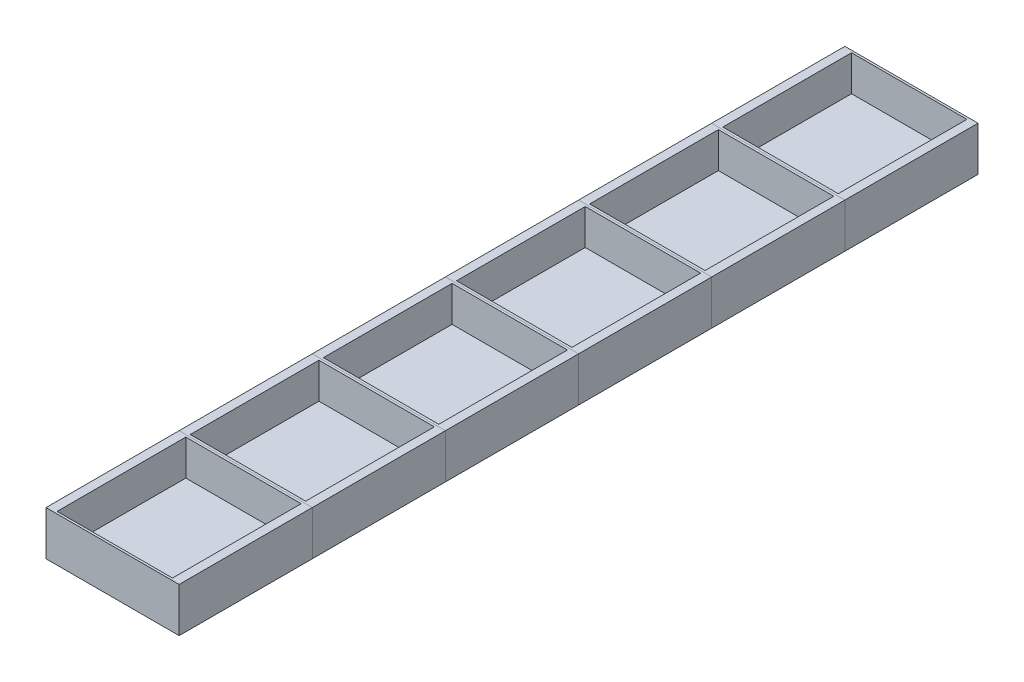
from build123d import *

# Parameters (mm, degrees)
SKETCH1_W           = 150
SKETCH1_H           = 150
BOSS_EXTRUDE1_DEPTH = 50
SKETCH2_W           = 130
SKETCH2_H           = 145
CUT_EXTRUDE1_DEPTH  = 40
LPATTERN9_COUNT     = 6
LPATTERN9_PITCH     = 150


with BuildPart() as part:
    # Sketch1 → Boss-Extrude1 (new body)
    with BuildSketch(Plane(origin=(0, 0, 0), x_dir=(1, 0, 0), z_dir=(0, 1, 0))):
        with Locations((0, 75)):
            Rectangle(SKETCH1_W, SKETCH1_H)
    extrude(amount=BOSS_EXTRUDE1_DEPTH)

    # Sketch2 → Cut-Extrude1 (cut)
    with BuildSketch(Plane(origin=(0, 50, 0), x_dir=(1, 0, 0), z_dir=(0, 1, 0))):
        with Locations((0, 75)):
            Rectangle(SKETCH2_W, SKETCH2_H)
    extrude(amount=-CUT_EXTRUDE1_DEPTH, mode=Mode.SUBTRACT)


with BuildPart() as lpattern9_1:
    # LPattern9: pattern copy
    add(part.part.moved(Location(Vector(0, 0, -1) * (1 * LPATTERN9_PITCH))))


with BuildPart() as lpattern9_2:
    # LPattern9: pattern copy
    add(part.part.moved(Location(Vector(0, 0, -1) * (2 * LPATTERN9_PITCH))))


with BuildPart() as lpattern9_3:
    # LPattern9: pattern copy
    add(part.part.moved(Location(Vector(0, 0, -1) * (3 * LPATTERN9_PITCH))))


with BuildPart() as lpattern9_4:
    # LPattern9: pattern copy
    add(part.part.moved(Location(Vector(0, 0, -1) * (4 * LPATTERN9_PITCH))))


with BuildPart() as lpattern9_5:
    # LPattern9: pattern copy
    add(part.part.moved(Location(Vector(0, 0, -1) * (5 * LPATTERN9_PITCH))))


solid = Compound([part.part, lpattern9_1.part, lpattern9_2.part, lpattern9_3.part, lpattern9_4.part, lpattern9_5.part])
